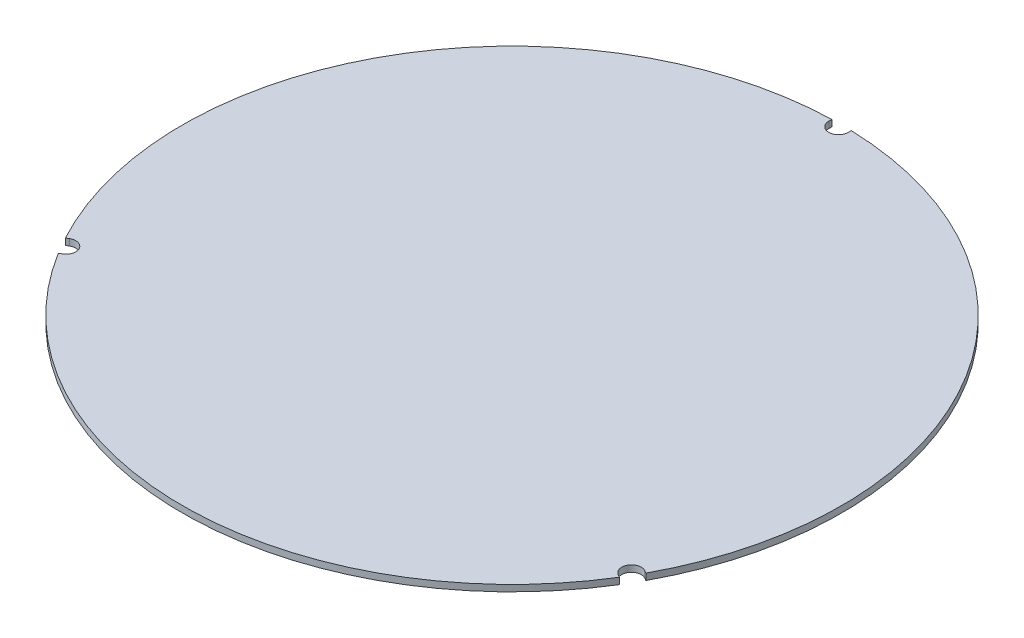
from build123d import *

# Parameters (mm, degrees)
SKETCH_1_R          = 51
EXTRUDE_1_DEPTH     = 1
SKETCH_2_R          = 1.5
CUT_EXTRUDE_1_DEPTH = 73.131823767
SKETCH_3_W          = 3
SKETCH_3_H          = 1
CUT_EXTRUDE_2_DEPTH = 73.131823767


with BuildPart() as part:
    # 草图1 → 凸台-拉伸1 (new body)
    with BuildSketch(Plane(origin=(0, 0, 0), x_dir=(1, 0, 0), z_dir=(0, 1, 0))):
        with Locations(Location((0, 0, 0), (0, 0, 270))):
            Circle(SKETCH_1_R)
    extrude(amount=EXTRUDE_1_DEPTH)

    # 草图2 → 切除-拉伸1 (cut, through all)
    with BuildSketch(Plane(origin=(0, 1, 0), x_dir=(1, 0, 0), z_dir=(0, 1, 0))):
        with Locations((0, 50.5)):
            Circle(SKETCH_2_R)
        with Locations((-43.734282891, -25.25)):
            Circle(SKETCH_2_R)
        with Locations((43.734282891, -25.25)):
            Circle(SKETCH_2_R)
    extrude(amount=-CUT_EXTRUDE_1_DEPTH, mode=Mode.SUBTRACT)

    # 草图3 → 切除-拉伸2 (cut, through all)
    with BuildSketch(Plane(origin=(0, 1, 0), x_dir=(1, 0, 0), z_dir=(0, 1, 0))):
        Polygon((-44.484282891, -23.950961894), (-45.350308295, -24.450961894), (-43.850308295, -27.049038106), (-42.984282891, -26.549038106), align=None)
        with Locations((0, 51)):
            Rectangle(SKETCH_3_W, SKETCH_3_H)
        Polygon((44.484282891, -23.950961894), (42.984282891, -26.549038106), (43.850308295, -27.049038106), (45.350308295, -24.450961894), align=None)
    extrude(amount=-CUT_EXTRUDE_2_DEPTH, mode=Mode.SUBTRACT)


solid = part.part
